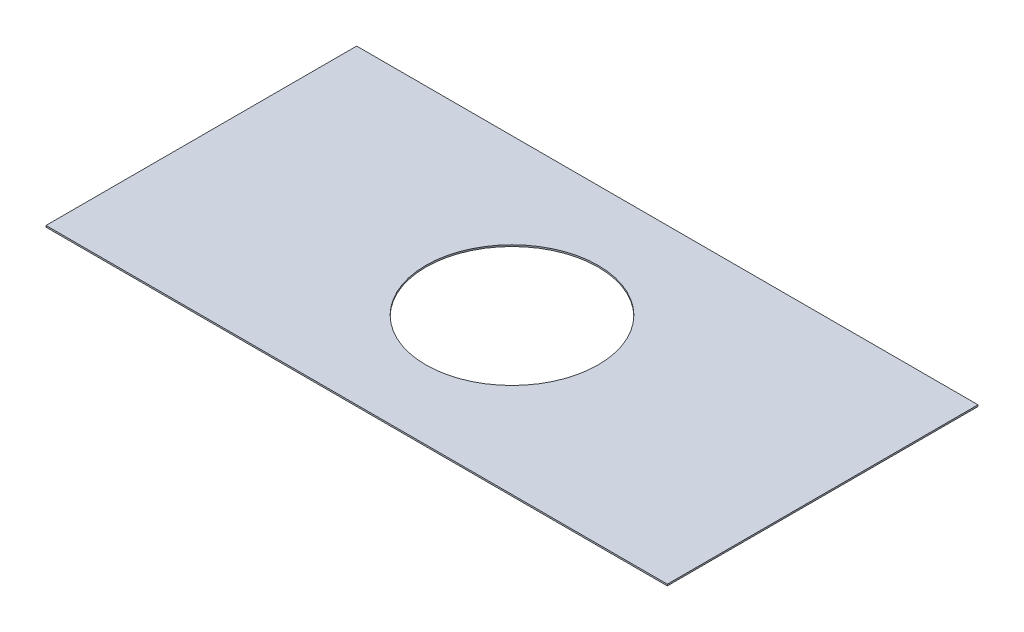
from build123d import *

# Parameters (mm, degrees)
SKETCH1_W           = 40
SKETCH1_H           = 20
SKETCH1_R           = 5.54891831
BOSS_EXTRUDE1_DEPTH = 0.1


with BuildPart() as part:
    # Sketch1 → Boss-Extrude1 (new body)
    with BuildSketch(Plane(origin=(0, 0, 0), x_dir=(1, 0, 0), z_dir=(0, 1, 0))):
        Rectangle(SKETCH1_W, SKETCH1_H)
        with Locations(Location((0, 0, 0), (0, 0, 270))):
            Circle(SKETCH1_R, mode=Mode.SUBTRACT)
    extrude(amount=BOSS_EXTRUDE1_DEPTH)


solid = part.part
